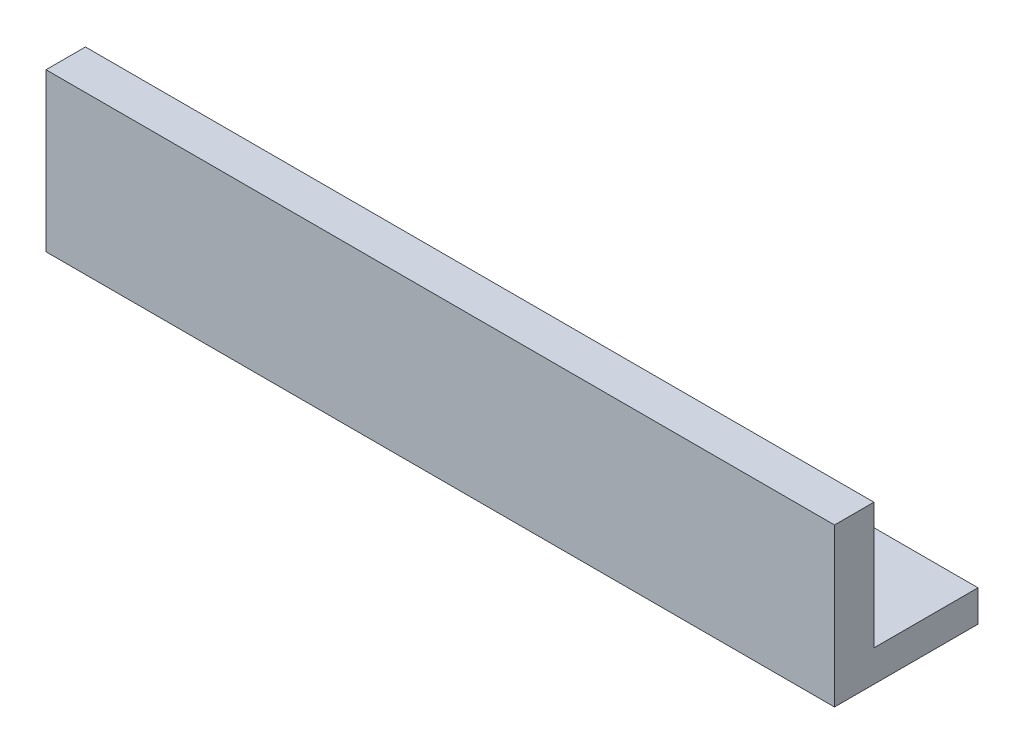
from build123d import *

# Parameters (mm, degrees)
SKETCH1_W           = 50
SKETCH1_H           = 8.6
BOSS_EXTRUDE2_DEPTH = 2
SKETCH3_W           = 50
SKETCH3_H           = 2
BOSS_EXTRUDE3_DEPTH = 8
SKETCH4_W           = 25
SKETCH4_H           = 6.6
CUT_EXTRUDE1_DEPTH  = 8
SKETCH5_W           = 25
SKETCH5_H           = 2
CUT_EXTRUDE2_DEPTH  = 2
SKETCH6_R           = 1.8
CUT_EXTRUDE3_DEPTH  = 2
BOSS_EXTRUDE4_DEPTH = 0.5
SKETCH8_W           = 25
SKETCH8_H           = 2
BOSS_EXTRUDE5_DEPTH = 2.5


with BuildPart() as part:
    # Sketch1 → Boss-Extrude2 (new body)
    with BuildSketch(Plane(origin=(0, 0, 0), x_dir=(1, 0, 0), z_dir=(0, 1, 0))):
        with Locations((25, 4.3)):
            Rectangle(SKETCH1_W, SKETCH1_H)
    extrude(amount=BOSS_EXTRUDE2_DEPTH)

    # Sketch3 → Boss-Extrude3 (add)
    with BuildSketch(Plane(origin=(0, 2, 0), x_dir=(1, 0, 0), z_dir=(0, 1, 0))):
        with Locations((25, 1)):
            Rectangle(SKETCH3_W, SKETCH3_H)
    extrude(amount=BOSS_EXTRUDE3_DEPTH)

    # Sketch4 → Cut-Extrude1 (cut)
    with BuildSketch(Plane(origin=(0, 2, 0), x_dir=(1, 0, 0), z_dir=(0, 1, 0))):
        with Locations((25, 5.3)):
            Rectangle(SKETCH4_W, SKETCH4_H)
    extrude(amount=-CUT_EXTRUDE1_DEPTH, mode=Mode.SUBTRACT)

    # Sketch5 → Cut-Extrude2 (cut)
    with BuildSketch(Plane(origin=(0, 0, -2), x_dir=(-1, 0, 0), z_dir=(0, 0, -1))):
        with Locations((-25, 1)):
            Rectangle(SKETCH5_W, SKETCH5_H)
    extrude(amount=-CUT_EXTRUDE2_DEPTH, mode=Mode.SUBTRACT)

    # Sketch6 → Cut-Extrude3 (cut)
    with BuildSketch(Plane(origin=(0, 2, 0), x_dir=(1, 0, 0), z_dir=(0, 1, 0))):
        with Locations(Location((43.75, 5.3, 0), (0, 0, 270))):
            Circle(SKETCH6_R)
        with Locations(Location((6.25, 5.3, 0), (0, 0, 270))):
            Circle(SKETCH6_R)
    extrude(amount=-CUT_EXTRUDE3_DEPTH, mode=Mode.SUBTRACT)

    # Sketch7 → Boss-Extrude4 (add)
    with BuildSketch(Plane.XY):
        Polygon((12.5, 0), (0, 0), (0, 10), (50, 10), (50, 0), (37.5, 0), (37.5, 2), (12.5, 2), align=None)
    extrude(amount=BOSS_EXTRUDE4_DEPTH)

    # Sketch8 → Boss-Extrude5 (add)
    with BuildSketch(Plane.XY.offset(0.5)):
        with Locations((25, 1)):
            Rectangle(SKETCH8_W, SKETCH8_H)
    extrude(amount=-BOSS_EXTRUDE5_DEPTH)


solid = part.part
